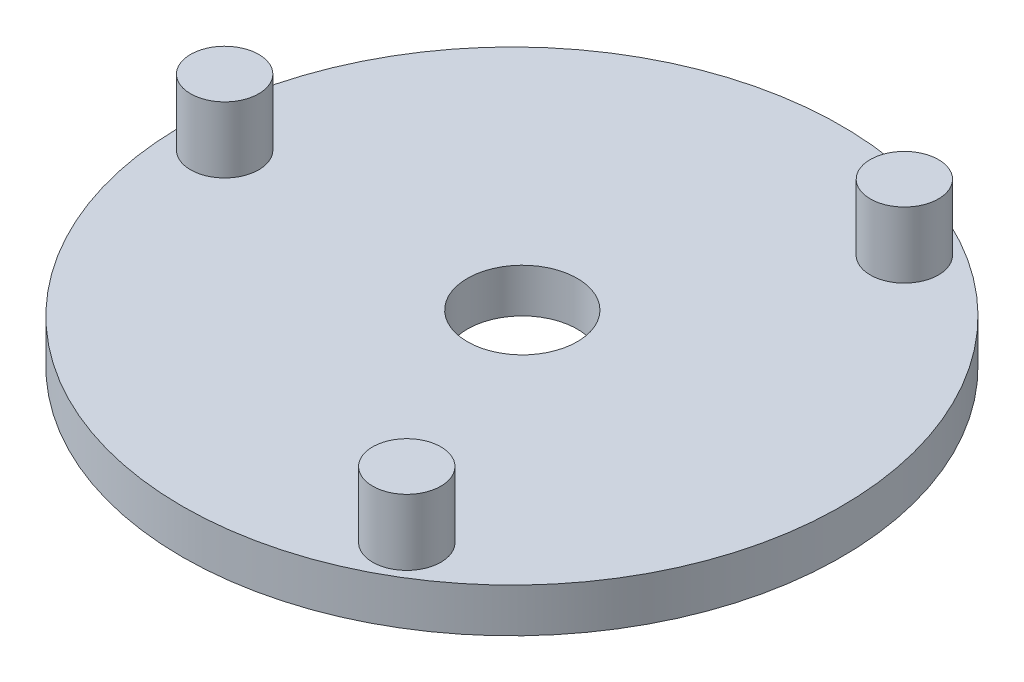
from build123d import *

# Parameters (mm, degrees)
SKETCH1_R           = 150
SKETCH1_R_2         = 25
BOSS_EXTRUDE1_DEPTH = 20
SKETCH2_R           = 15.517679246
BOSS_EXTRUDE2_DEPTH = 30
SKETCH3_R           = 15.012096723
BOSS_EXTRUDE3_DEPTH = 20


with BuildPart() as part:
    # Sketch1 → Boss-Extrude1 (new body)
    with BuildSketch(Plane(origin=(0, 0, 0), x_dir=(1, 0, 0), z_dir=(0, 1, 0))):
        with Locations(Location((0, 0, 0), (0, 0, 270))):
            Circle(SKETCH1_R)
        with Locations(Location((0, 4.724194593, 0), (0, 0, 270))):
            Circle(SKETCH1_R_2, mode=Mode.SUBTRACT)
    extrude(amount=BOSS_EXTRUDE1_DEPTH)

    # Sketch2 → Boss-Extrude2 (add)
    with BuildSketch(Plane(origin=(0, 20, 0), x_dir=(1, 0, 0), z_dir=(0, 1, 0))):
        with Locations(Location((-130.753213973, 0, 0), (0, 0, 270))):
            Circle(SKETCH2_R)
        with Locations(Location((65.376606987, 113.235604927, 0), (0, 0, 270))):
            Circle(SKETCH2_R)
        with Locations(Location((65.376606987, -113.235604927, 0), (0, 0, 270))):
            Circle(SKETCH2_R)
    extrude(amount=BOSS_EXTRUDE2_DEPTH)

    # Sketch3 → Boss-Extrude3 (add)
    with BuildSketch(Plane.XZ):
        with Locations(Location((-103.00688249, 22.854430971, 0), (0, 0, 90))):
            Circle(SKETCH3_R)
        with Locations(Location((22.854430971, 103.00688249, 0), (0, 0, 90))):
            Circle(SKETCH3_R)
        with Locations(Location((103.00688249, -22.854430971, 0), (0, 0, 90))):
            Circle(SKETCH3_R)
        with Locations(Location((-22.854430971, -103.00688249, 0), (0, 0, 90))):
            Circle(SKETCH3_R)
    extrude(amount=BOSS_EXTRUDE3_DEPTH)


solid = part.part
